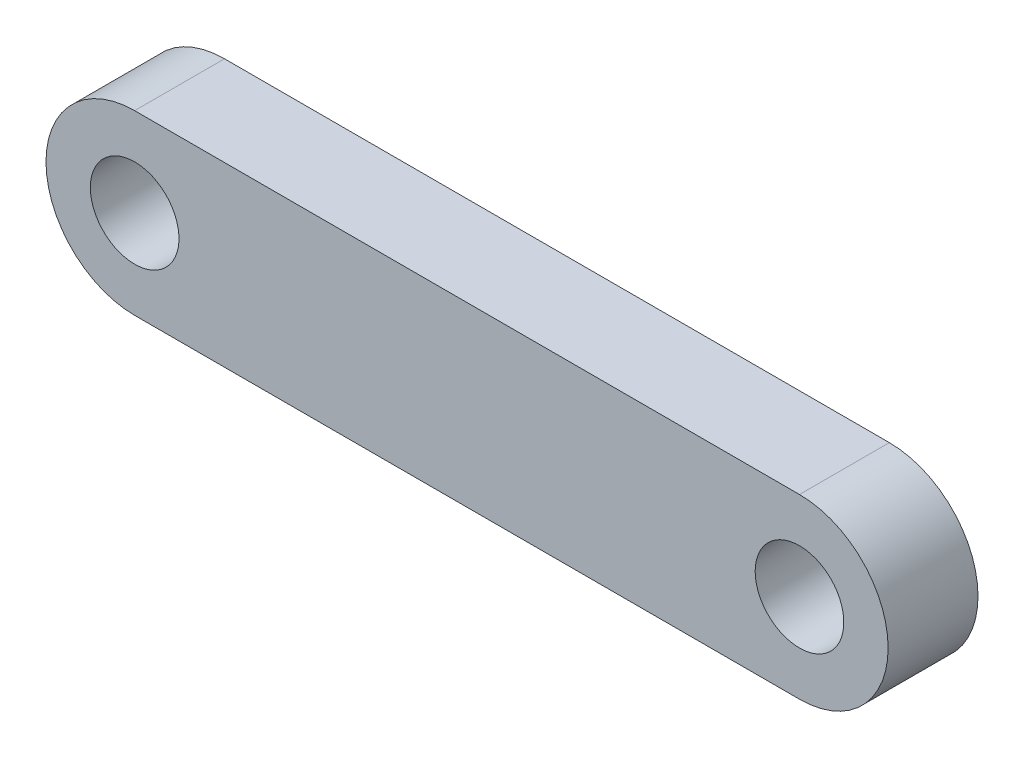
from build123d import *

# Parameters (mm, degrees)
SKETCH1_R           = 1.27
BOSS_EXTRUDE1_DEPTH = 2.575


with BuildPart() as part:
    # Sketch1 → Boss-Extrude1 (new body)
    with BuildSketch(Plane.XY):
        with BuildLine():
            Line((-9.525, 2.54), (9.525, 2.54))
            ThreePointArc((9.525, 2.54), (12.065, 0), (9.525, -2.54))
            Line((9.525, -2.54), (-9.525, -2.54))
            ThreePointArc((-9.525, -2.54), (-12.065, 0), (-9.525, 2.54))
        make_face()
        with Locations(Location((-9.525, 0, 0), (0, 0, 180))):
            Circle(SKETCH1_R, mode=Mode.SUBTRACT)
        with Locations(Location((9.525, 0, 0), (0, 0, 180))):
            Circle(SKETCH1_R, mode=Mode.SUBTRACT)
    extrude(amount=BOSS_EXTRUDE1_DEPTH)


solid = part.part
